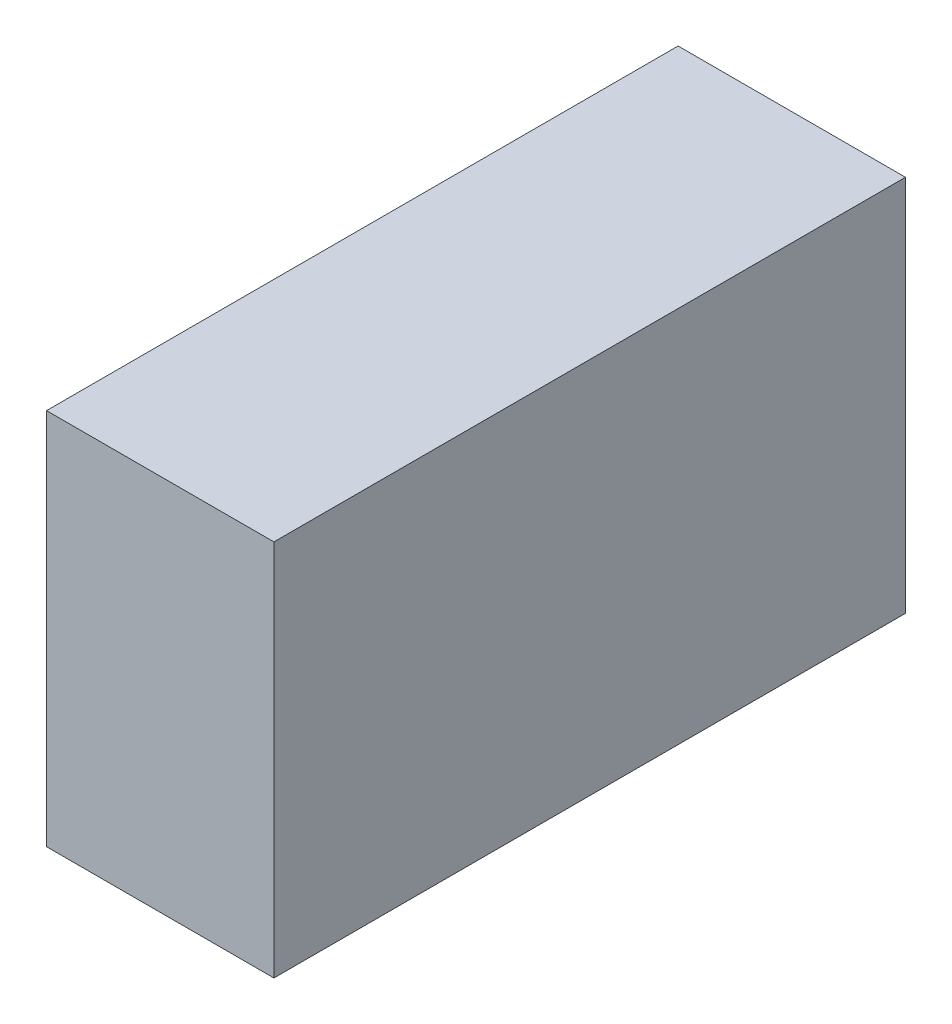
from build123d import *

# Parameters (mm, degrees)
SKETCH1_W           = 9
SKETCH1_H           = 25
BOSS_EXTRUDE1_DEPTH = 14.95053


with BuildPart() as part:
    # Sketch1 → Boss-Extrude1 (new body)
    with BuildSketch(Plane(origin=(0, 0, 0), x_dir=(1, 0, 0), z_dir=(0, 1, 0))):
        with Locations((-2.449152542, -8.474576271)):
            Rectangle(SKETCH1_W, SKETCH1_H)
    extrude(amount=BOSS_EXTRUDE1_DEPTH)


solid = part.part
